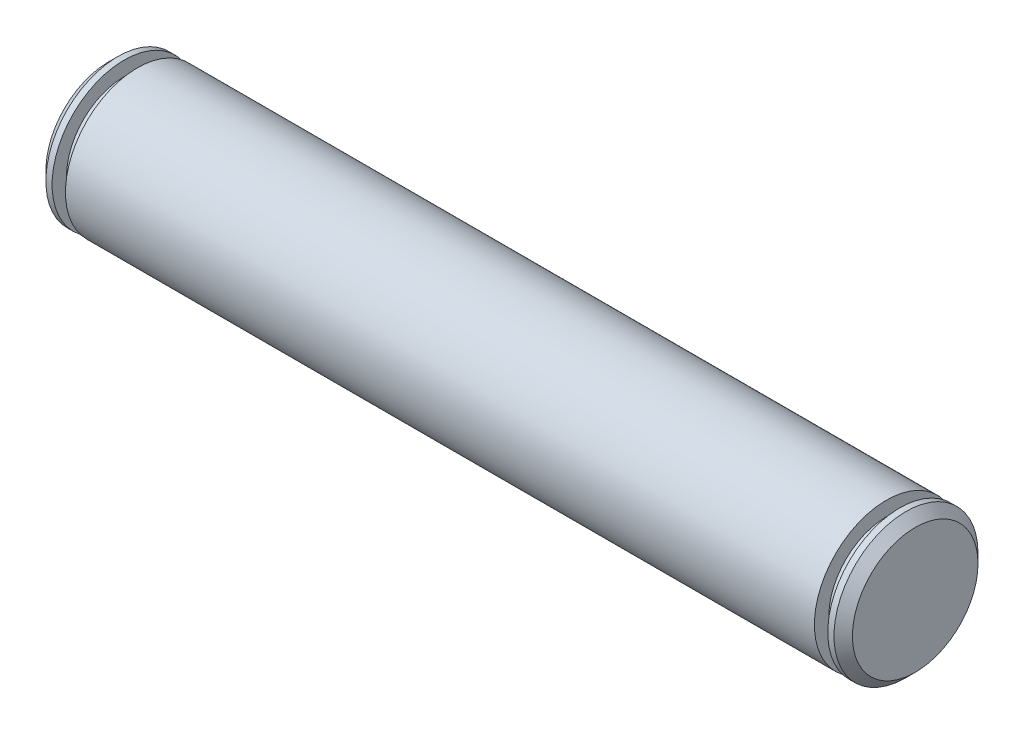
from build123d import *

# Parameters (mm, degrees)
SKETCH1_R           = 3.96875
BOSS_EXTRUDE1_DEPTH = 22.225
CHAMFER1_SIZE       = 0.508
CUT_EXTRUDE1_START  = 0.7366
SKETCH2_R           = 3.96875
SKETCH2_R_2         = 3.175
CUT_EXTRUDE1_DEPTH  = 0.7366


with BuildPart() as part:
    # Sketch1 → Boss-Extrude1 (new, symmetric)
    with BuildSketch(Plane(origin=(0, 0, 0), x_dir=(0, 0, -1), z_dir=(1, 0, 0))):
        Circle(SKETCH1_R)
    extrude(amount=BOSS_EXTRUDE1_DEPTH, both=True)

    # Chamfer1
    chamfer1_edges = [part.edges().sort_by_distance(p)[0] for p in [
        (-22.225, 0, 3.96875),
        (22.225, 0, 3.96875),
    ]]
    chamfer(chamfer1_edges, length=CHAMFER1_SIZE)

    # Sketch2 → Cut-Extrude1 (cut)
    with BuildSketch(Plane(origin=(20.6375, 0, 0), x_dir=(0, 0, -1), z_dir=(1, 0, 0)).offset(CUT_EXTRUDE1_START)):
        Circle(SKETCH2_R)
        Circle(SKETCH2_R_2, mode=Mode.SUBTRACT)
    cut_extrude1 = extrude(amount=-CUT_EXTRUDE1_DEPTH, mode=Mode.SUBTRACT)

    # Mirror1: Cut-Extrude1 across plane
    add(cut_extrude1.mirror(Plane(origin=(0, 0, 0), x_dir=(0, 0, 1), z_dir=(1, 0, 0))), mode=Mode.SUBTRACT)


solid = part.part
